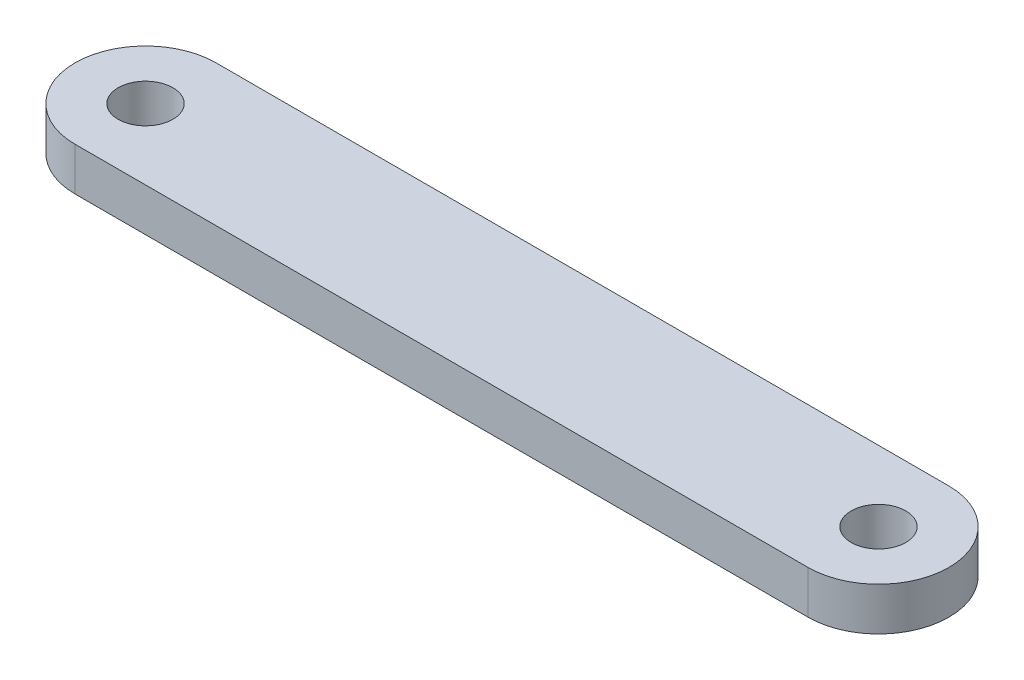
from build123d import *

# Parameters (mm, degrees)
SKETCH1_R           = 3.175
BOSS_EXTRUDE1_DEPTH = 5


with BuildPart() as part:
    # Sketch1 → Boss-Extrude1 (new body)
    with BuildSketch(Plane(origin=(0, 5, 0), x_dir=(1, 0, 0), z_dir=(0, 1, 0))):
        with BuildLine():
            Line((-95.112504269, 3.933497355), (-10.112504269, 3.933497355))
            ThreePointArc((-10.112504269, 3.933497355), (-1.937504269, 12.108497355), (-10.112504269, 20.283497355))
            Line((-10.112504269, 20.283497355), (-95.112504269, 20.283497355))
            ThreePointArc((-95.112504269, 20.283497355), (-103.287504269, 12.108497355), (-95.112504269, 3.933497355))
        make_face()
        with Locations(Location((-95.112504269, 12.108497355, 0), (0, 0, 90))):
            Circle(SKETCH1_R, mode=Mode.SUBTRACT)
        with Locations(Location((-10.112504269, 12.108497355, 0), (0, 0, 90))):
            Circle(SKETCH1_R, mode=Mode.SUBTRACT)
    extrude(amount=-BOSS_EXTRUDE1_DEPTH)


solid = part.part
